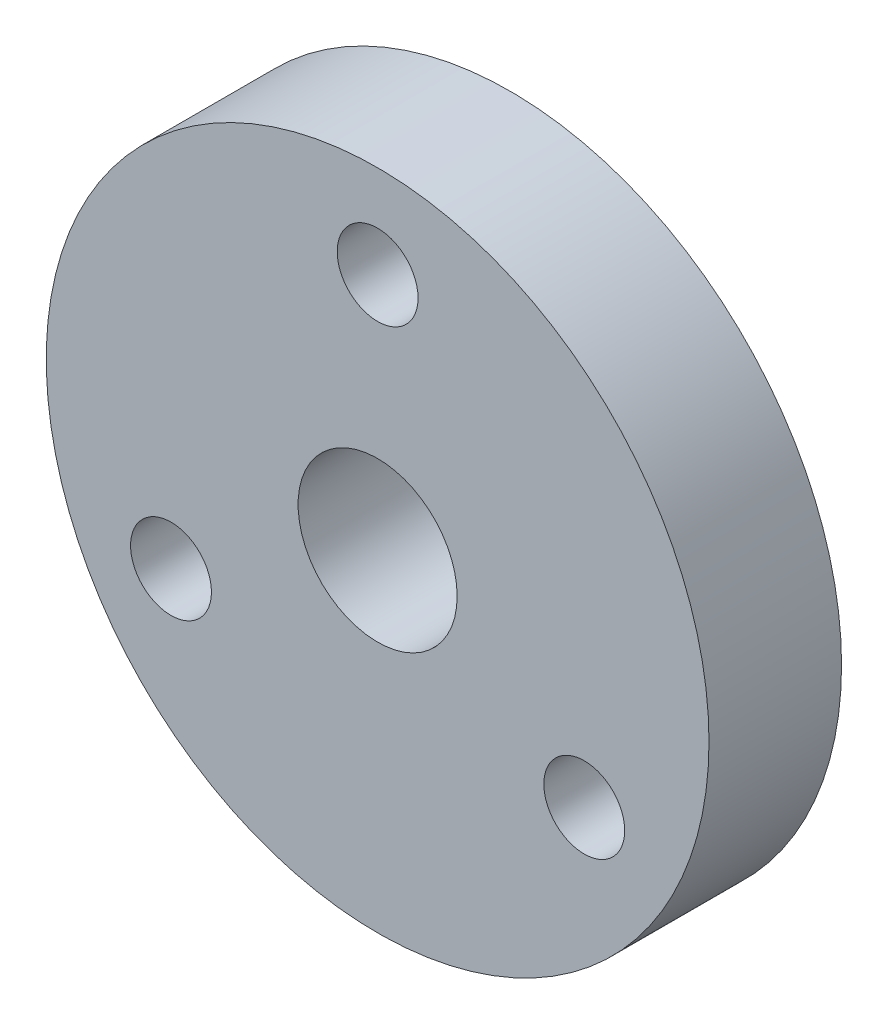
from build123d import *

# Parameters (mm, degrees)
SKETCH1_R           = 12.5
BOSS_EXTRUDE1_DEPTH = 5
CUT_EXTRUDE2_REACH  = 20.371
SKETCH3_R           = 3
CUT_EXTRUDE3_REACH  = 20.371
SKETCH4_R           = 1.525


with BuildPart() as part:
    # Sketch1 → Boss-Extrude1 (new body)
    with BuildSketch(Plane.XY):
        Circle(SKETCH1_R)
    extrude(amount=BOSS_EXTRUDE1_DEPTH)

    # Sketch3 → Cut-Extrude2 (cut, up to next)
    with BuildSketch(Plane.XY.offset(5), mode=Mode.PRIVATE) as cut_extrude2_sk1:
        Circle(SKETCH3_R)
    cut_extrude2_tool1 = extrude(cut_extrude2_sk1.sketch, amount=-CUT_EXTRUDE2_REACH, mode=Mode.PRIVATE) & part.part
    add(cut_extrude2_tool1.solids().sort_by_distance((0, 0, 5))[0], mode=Mode.SUBTRACT)

    # Sketch4 → Cut-Extrude3 (cut, up to next)
    with BuildSketch(Plane.XY.offset(5), mode=Mode.PRIVATE) as cut_extrude3_sk1:
        with Locations((0, 9)):
            Circle(SKETCH4_R)
    cut_extrude3_tool1 = extrude(cut_extrude3_sk1.sketch, amount=-CUT_EXTRUDE3_REACH, mode=Mode.PRIVATE) & part.part
    # Sketch4 → Cut-Extrude3 (cut, up to next)
    with BuildSketch(Plane.XY.offset(5), mode=Mode.PRIVATE) as cut_extrude3_sk2:
        with Locations((7.794228634, -4.5)):
            Circle(SKETCH4_R)
    cut_extrude3_tool2 = extrude(cut_extrude3_sk2.sketch, amount=-CUT_EXTRUDE3_REACH, mode=Mode.PRIVATE) & part.part
    # Sketch4 → Cut-Extrude3 (cut, up to next)
    with BuildSketch(Plane.XY.offset(5), mode=Mode.PRIVATE) as cut_extrude3_sk3:
        with Locations((-7.794228634, -4.5)):
            Circle(SKETCH4_R)
    cut_extrude3_tool3 = extrude(cut_extrude3_sk3.sketch, amount=-CUT_EXTRUDE3_REACH, mode=Mode.PRIVATE) & part.part
    add(cut_extrude3_tool1.solids().sort_by_distance((0, 9, 5))[0], mode=Mode.SUBTRACT)
    add(cut_extrude3_tool2.solids().sort_by_distance((7.794229, -4.5, 5))[0], mode=Mode.SUBTRACT)
    add(cut_extrude3_tool3.solids().sort_by_distance((-7.794229, -4.5, 5))[0], mode=Mode.SUBTRACT)


solid = part.part
